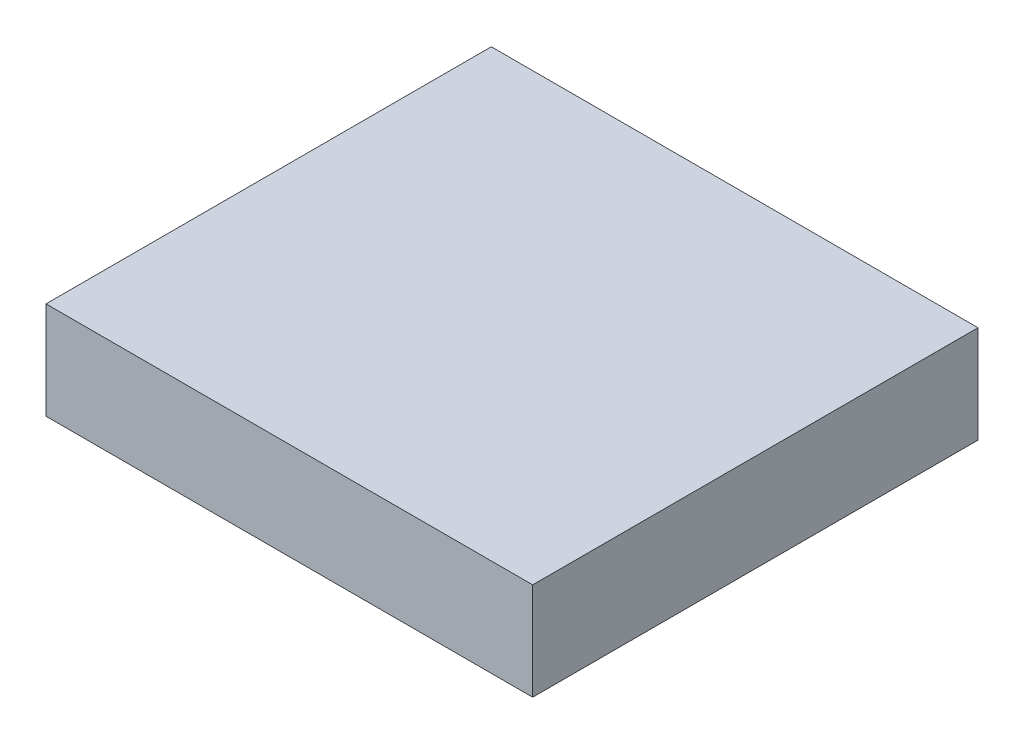
from build123d import *

# Parameters (mm, degrees)
SKETCH1_W           = 20
SKETCH1_H           = 18.3
BOSS_EXTRUDE1_DEPTH = 4


with BuildPart() as part:
    # Sketch1 → Boss-Extrude1 (new body)
    with BuildSketch(Plane(origin=(0, 0, 0), x_dir=(1, 0, 0), z_dir=(0, 1, 0))):
        Rectangle(SKETCH1_W, SKETCH1_H)
    extrude(amount=BOSS_EXTRUDE1_DEPTH)


solid = part.part
